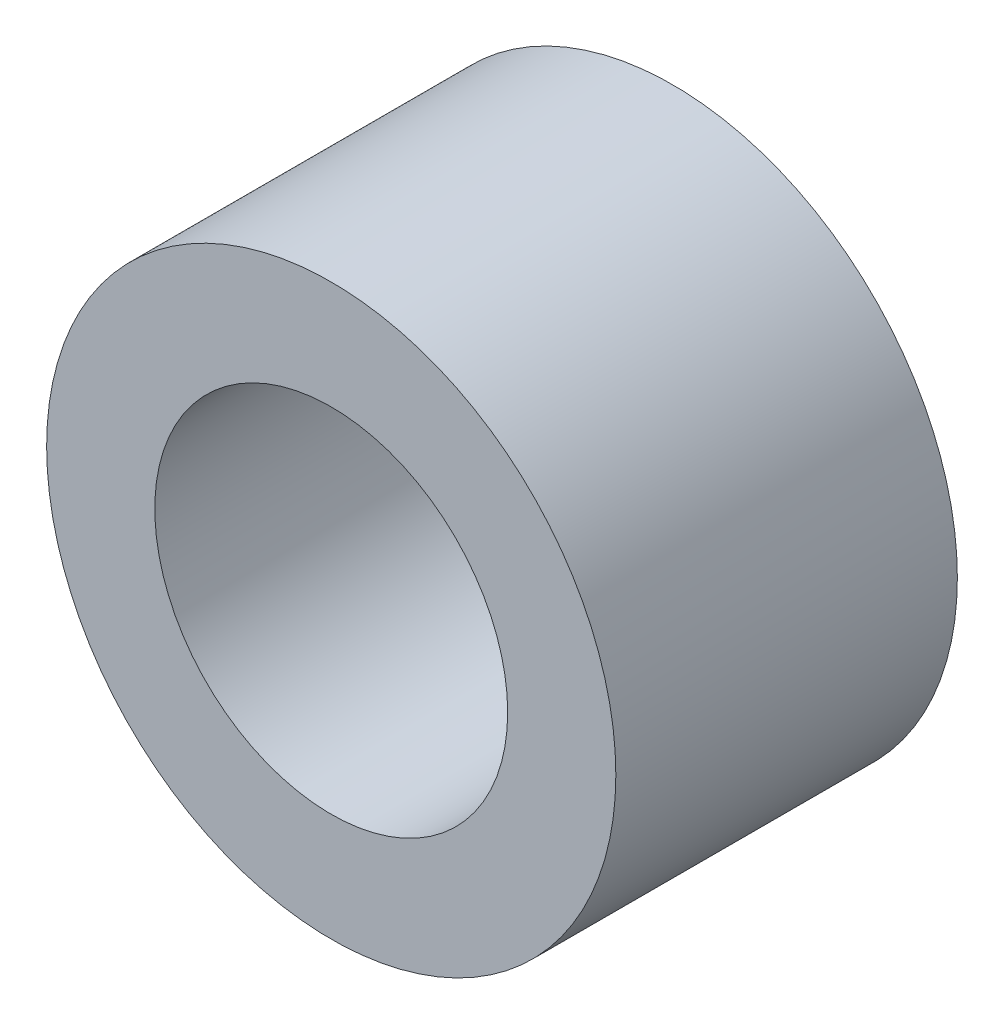
from build123d import *

# Parameters (mm, degrees)
SKETCH1_R           = 5
SKETCH1_R_2         = 3.1
BOSS_EXTRUDE1_DEPTH = 6


with BuildPart() as part:
    # Sketch1 → Boss-Extrude1 (new body)
    with BuildSketch(Plane.XY):
        Circle(SKETCH1_R)
        Circle(SKETCH1_R_2, mode=Mode.SUBTRACT)
    extrude(amount=BOSS_EXTRUDE1_DEPTH)


solid = part.part
